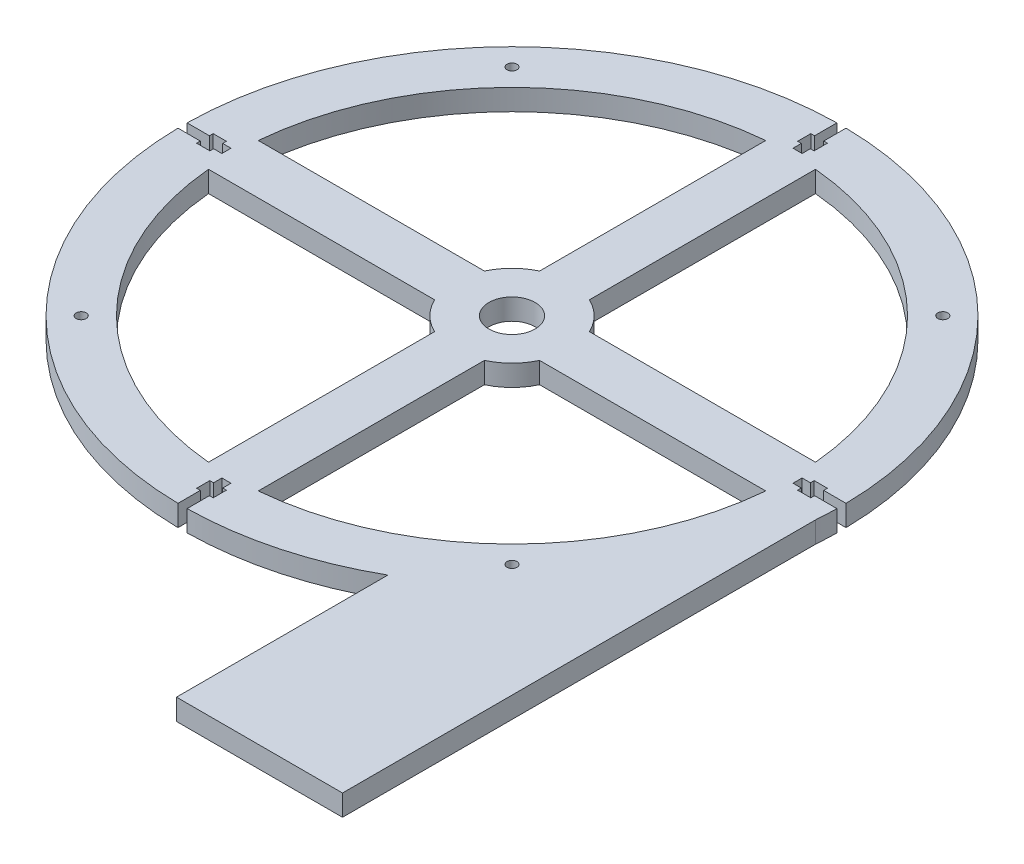
from build123d import *

# Parameters (mm, degrees)
BOSS_EXTRUDE1_DEPTH      = 3.175
SKETCH2_W                = 2.75
SKETCH2_H                = 2.5
SKETCH2_H_2              = 4
SKETCH2_W_2              = 1.125
SKETCH2_H_3              = 7.5
CUT_EXTRUDE1_DEPTH       = 180.884021717
CIRPATTERN1_COUNT        = 4
F_3_0_3_DIAMETER_HOLE1_D = 3
F_1_2_CLEARANCE_HOLE1_D  = 13.89126


with BuildPart() as part:
    # Sketch1 → Boss-Extrude1 (new, symmetric)
    with BuildSketch(Plane(origin=(0, 0, 0), x_dir=(1, 0, 0), z_dir=(0, 1, 0))):
        with BuildLine():
            Line((98.95418457, -7.5), (98.95418457, -150))
            Line((98.95418457, -150), (48.95418457, -150))
            Line((48.95418457, -150), (48.95418457, -86.323047079))
            ThreePointArc((48.95418457, -86.323047079), (-83.800295961, 53.157229431), (98.95418457, -7.5))
        make_face()
        with BuildLine():
            Line((-83.903460262, -7.5), (-15.811388301, -7.5))
            ThreePointArc((-15.811388301, -7.5), (-12.374368671, -12.374368671), (-7.5, -15.811388301))
            Line((-7.5, -15.811388301), (-7.5, -83.903460262))
            ThreePointArc((-7.5, -83.903460262), (-59.565261034, -59.565261034), (-83.903460262, -7.5))
        make_face(mode=Mode.SUBTRACT)
        with BuildLine():
            Line((7.5, -83.903460262), (7.5, -15.811388301))
            ThreePointArc((7.5, -15.811388301), (12.374368671, -12.374368671), (15.811388301, -7.5))
            Line((15.811388301, -7.5), (83.903460262, -7.5))
            ThreePointArc((83.903460262, -7.5), (59.565261034, -59.565261034), (7.5, -83.903460262))
        make_face(mode=Mode.SUBTRACT)
        with BuildLine():
            Line((-83.903460262, 7.5), (-15.811388301, 7.5))
            ThreePointArc((-15.811388301, 7.5), (-12.374368671, 12.374368671), (-7.5, 15.811388301))
            Line((-7.5, 15.811388301), (-7.5, 83.903460262))
            ThreePointArc((-7.5, 83.903460262), (-59.565261034, 59.565261034), (-83.903460262, 7.5))
        make_face(mode=Mode.SUBTRACT)
        with BuildLine():
            Line((7.5, 15.811388301), (7.5, 83.903460262))
            ThreePointArc((7.5, 83.903460262), (59.565261034, 59.565261034), (83.903460262, 7.5))
            Line((83.903460262, 7.5), (15.811388301, 7.5))
            ThreePointArc((15.811388301, 7.5), (12.374368671, 12.374368671), (7.5, 15.811388301))
        make_face(mode=Mode.SUBTRACT)
    extrude(amount=BOSS_EXTRUDE1_DEPTH, both=True)

    # Sketch2 → Cut-Extrude1 (cut, symmetric)
    with BuildSketch(Plane(origin=(0, 0, 0), x_dir=(1, 0, 0), z_dir=(0, 1, 0))):
        with Locations((0, 87.25)):
            Rectangle(SKETCH2_W, SKETCH2_H)
        with Locations((0, 90.5)):
            Rectangle(SKETCH2_W, SKETCH2_H_2)
        with Locations((1.9375, 90.5)):
            Rectangle(SKETCH2_W_2, SKETCH2_H_2)
        with Locations((0, 96.25)):
            Rectangle(SKETCH2_W, SKETCH2_H_3)
        with Locations((-1.9375, 90.5)):
            Rectangle(SKETCH2_W_2, SKETCH2_H_2)
    cut_extrude1 = extrude(amount=CUT_EXTRUDE1_DEPTH, both=True, mode=Mode.SUBTRACT)

    # CirPattern1: Cut-Extrude1 ×4 about axis
    cirpattern1_axis = Axis((0, 0, 0), (0, 1, 0))
    for i in range(1, CIRPATTERN1_COUNT):
        add(cut_extrude1.rotate(cirpattern1_axis, i * 360 / CIRPATTERN1_COUNT), mode=Mode.SUBTRACT)

    # Ø3.0 (3) Diameter Hole1 (through all)
    with Locations(Plane(origin=(0, 3.175, 0), x_dir=(1, 0, 0), z_dir=(0, 1, 0))):
        with Locations((-64.868561892, -64.868561892), (-64.868561892, 64.868561892), (64.868561892, 64.868561892), (64.868561892, -64.868561892)):
            Hole(F_3_0_3_DIAMETER_HOLE1_D / 2)

    # 1/2 Clearance Hole1 (through all)
    with Locations(Plane(origin=(0, 3.175, 0), x_dir=(1, 0, 0), z_dir=(0, 1, 0))):
        with Locations((0, 0)):
            Hole(F_1_2_CLEARANCE_HOLE1_D / 2)


solid = part.part
